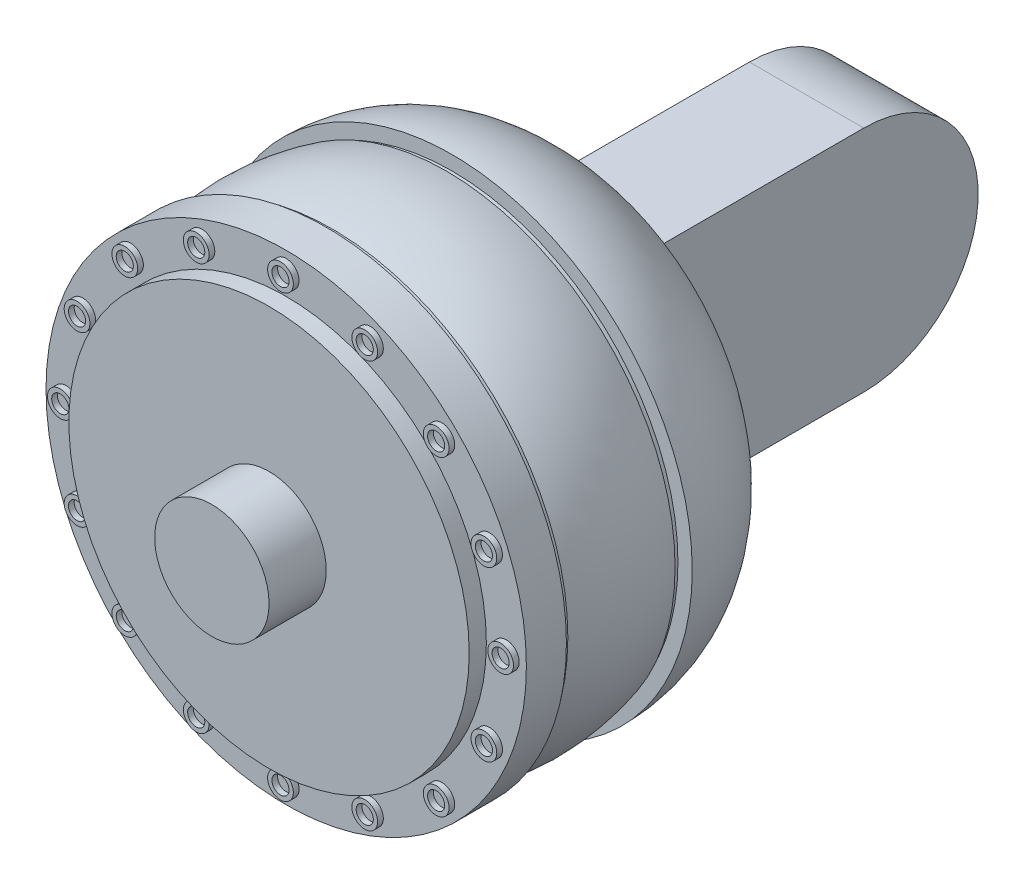
from build123d import *

# Parameters (mm, degrees)
SKETCH2_R           = 39.5
BOSS_EXTRUDE1_DEPTH = 1
SKETCH4_R           = 41.25
BOSS_EXTRUDE2_DEPTH = 1
SKETCH5_R           = 42
BOSS_EXTRUDE3_DEPTH = 7
SKETCH6_R           = 35
BOSS_EXTRUDE4_DEPTH = 3
SKETCH7_R           = 2.25
SKETCH7_R_2         = 1.5
BOSS_EXTRUDE5_DEPTH = 1
CIRPATTERN1_COUNT   = 16
SKETCH8_W           = 20
SKETCH8_H           = 40
BOSS_EXTRUDE6_DEPTH = 42
SKETCH9_R           = 20
BOSS_EXTRUDE7_DEPTH = 20
SKETCH10_R          = 10
BOSS_EXTRUDE8_DEPTH = 10
SKETCH11_R          = 10
BOSS_EXTRUDE9_DEPTH = 10


with BuildPart() as part:
    # Sketch1 → Revolve1 (revolve)
    with BuildSketch(Plane(origin=(0, 0, 0), x_dir=(1, 0, 0), z_dir=(0, 1, 0))):
        with BuildLine():
            Line((0, 0), (0, -20))
            Line((0, -20), (-42, -20))
            ThreePointArc((-42, -20), (-39.360679775, -8.819660113), (-32, 0))
            Line((-32, 0), (0, 0))
        make_face()
    revolve(axis=Axis((0, 0, 0), (0, 0, 1)))

    # Sketch2 → Boss-Extrude1 (add)
    with BuildSketch(Plane.XY.offset(20)):
        Circle(SKETCH2_R)
    extrude(amount=BOSS_EXTRUDE1_DEPTH)

    # Sketch3 → Revolve2 (revolve)
    with BuildSketch(Plane(origin=(0, 0, 0), x_dir=(1, 0, 0), z_dir=(0, 1, 0))):
        with BuildLine():
            Line((0, -21), (-40, -21))
            ThreePointArc((-40, -21), (-41.376973739, -31), (-40, -41))
            Line((-40, -41), (0, -41))
            Line((0, -41), (0, -21))
        make_face()
    revolve(axis=Axis((0, 0, 21), (0, 0, 1)))

    # Sketch4 → Boss-Extrude2 (add)
    with BuildSketch(Plane.XY.offset(41)):
        Circle(SKETCH4_R)
    extrude(amount=BOSS_EXTRUDE2_DEPTH)

    # Sketch5 → Boss-Extrude3 (add)
    with BuildSketch(Plane.XY.offset(42)):
        Circle(SKETCH5_R)
    extrude(amount=BOSS_EXTRUDE3_DEPTH)

    # Sketch6 → Boss-Extrude4 (add)
    with BuildSketch(Plane.XY.offset(49)):
        Circle(SKETCH6_R)
    extrude(amount=BOSS_EXTRUDE4_DEPTH)

    # Sketch7 → Boss-Extrude5 (add)
    with BuildSketch(Plane.XY.offset(49)):
        with Locations((38.5, 0)):
            Circle(SKETCH7_R)
        with Locations((38.5, 0)):
            Circle(SKETCH7_R_2, mode=Mode.SUBTRACT)
    boss_extrude5 = extrude(amount=BOSS_EXTRUDE5_DEPTH)

    # CirPattern1: Boss-Extrude5 ×16 about axis
    cirpattern1_axis = Axis((0, 0, 0), (0, 0, 1))
    for i in range(1, CIRPATTERN1_COUNT):
        add(boss_extrude5.rotate(cirpattern1_axis, i * 360 / CIRPATTERN1_COUNT))

    # Sketch8 → Boss-Extrude6 (add)
    with BuildSketch(Plane(origin=(0, 0, 0), x_dir=(-1, 0, 0), z_dir=(0, 0, -1))):
        Rectangle(SKETCH8_W, SKETCH8_H)
    extrude(amount=BOSS_EXTRUDE6_DEPTH)

    # Sketch9 → Boss-Extrude7 (add)
    with BuildSketch(Plane.ZY.offset(10)):
        with Locations((-42, 0)):
            Circle(SKETCH9_R)
    extrude(amount=-BOSS_EXTRUDE7_DEPTH)

    # Sketch10 → Boss-Extrude8 (add)
    with BuildSketch(Plane.ZY.offset(10)):
        with Locations(Location((-42, 0, 0), (0, 0, 180))):
            Circle(SKETCH10_R)
    extrude(amount=BOSS_EXTRUDE8_DEPTH)

    # Sketch11 → Boss-Extrude9 (add)
    with BuildSketch(Plane.XY.offset(52)):
        Circle(SKETCH11_R)
    extrude(amount=BOSS_EXTRUDE9_DEPTH)


solid = part.part
